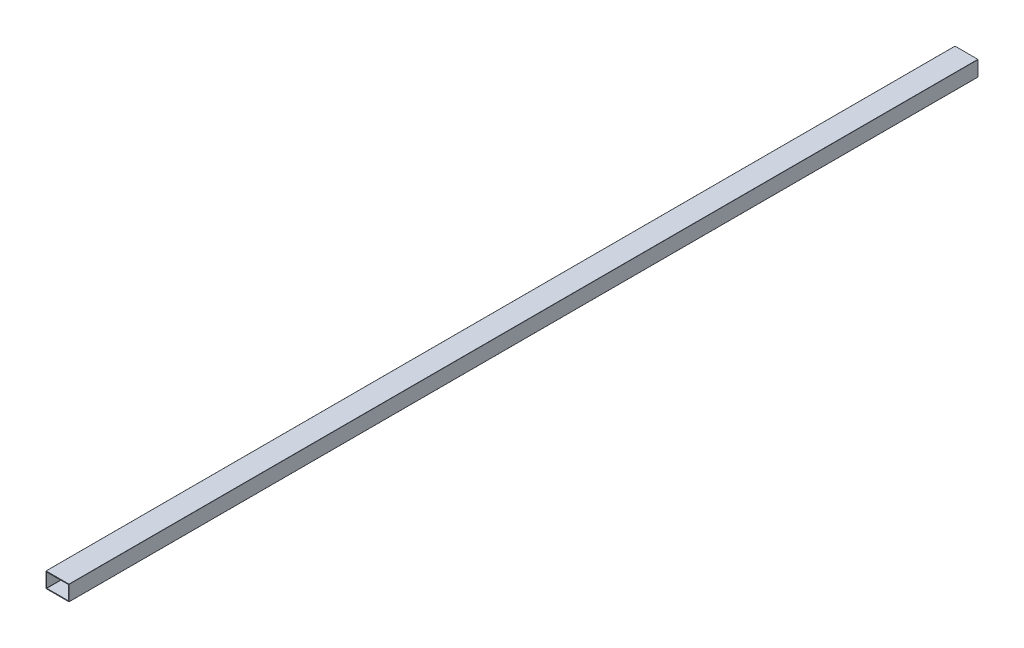
from build123d import *

# Parameters (mm, degrees)
CROQUIS1_W              = 152.4
CROQUIS1_H              = 101.6
CROQUIS1_W_2            = 143.3
CROQUIS1_H_2            = 92.5
SALIENTE_EXTRUIR1_DEPTH = 6000
REDONDEO1_R             = 1


with BuildPart() as part:
    # Croquis1 → Saliente-Extruir1 (new body)
    with BuildSketch(Plane.XY):
        Rectangle(CROQUIS1_W, CROQUIS1_H)
        Rectangle(CROQUIS1_W_2, CROQUIS1_H_2, mode=Mode.SUBTRACT)
    extrude(amount=-SALIENTE_EXTRUIR1_DEPTH)

    # Redondeo1
    redondeo1_edges = [part.edges().sort_by_distance(p)[0] for p in [
        (71.65, -46.25, -3000),
        (-71.65, -46.25, -3000),
        (-71.65, 46.25, -3000),
        (71.65, 46.25, -3000),
        (76.2, -50.8, -3000),
        (-76.2, -50.8, -3000),
        (-76.2, 50.8, -3000),
        (76.2, 50.8, -3000),
    ]]
    fillet(redondeo1_edges, radius=REDONDEO1_R)


solid = part.part
